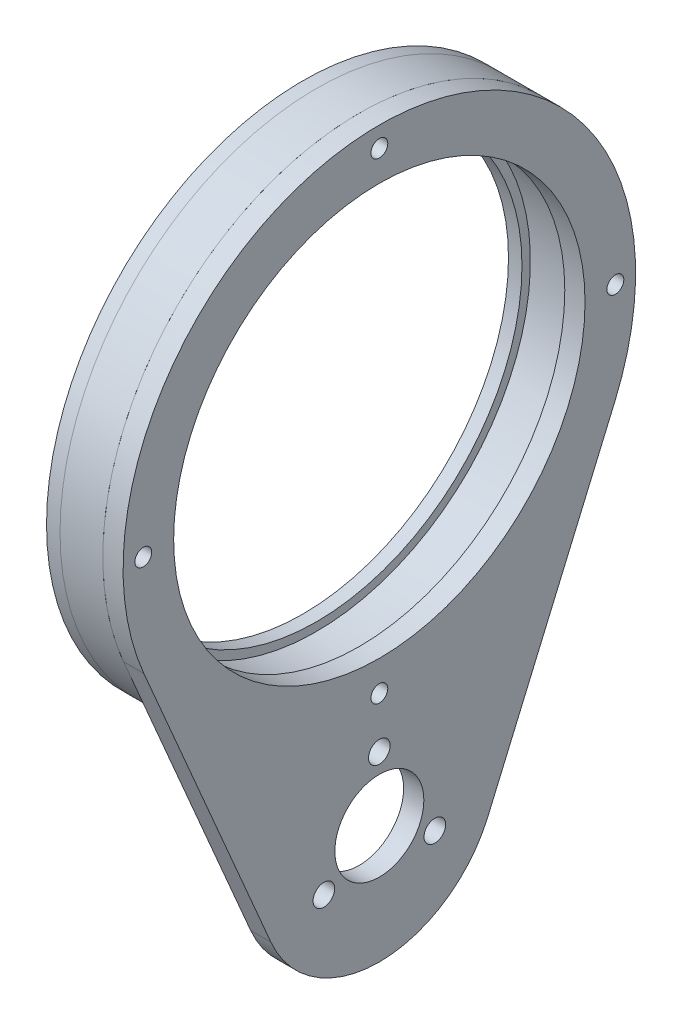
from build123d import *

# Parameters (mm, degrees)
SKETCH_2_R      = 6.6
SKETCH_2_R_2    = 1.6
SKETCH_2_R_3    = 30.5
SKETCH_2_R_4    = 1.25
EXTRUDE_1_DEPTH = 3
SKETCH_6_R      = 38
SKETCH_6_R_2    = 31.75
SKETCH_6_R_3    = 1.6
EXTRUDE_4_DEPTH = 6.35
SKETCH_7_R      = 38
SKETCH_7_R_2    = 30.5
SKETCH_7_R_3    = 1.6
EXTRUDE_5_DEPTH = 2


with BuildPart() as part:
    # ｽｹｯﾁ2 → ﾎﾞｽ - 押し出し1 (new body)
    with BuildSketch(Plane(origin=(0, 0, 0), x_dir=(0, 0, -1), z_dir=(1, 0, 0))):
        with BuildLine():
            Line((-34.922436245, 37.019230769), (-16.082700902, -6.899038462))
            ThreePointArc((-16.082700902, -6.899038462), (0, -17.5), (16.082700902, -6.899038462))
            Line((16.082700902, -6.899038462), (34.922436245, 37.019230769))
            ThreePointArc((34.922436245, 37.019230769), (0, 90), (-34.922436245, 37.019230769))
        make_face()
        Circle(SKETCH_2_R, mode=Mode.SUBTRACT)
        with Locations((0, 9.5)):
            Circle(SKETCH_2_R_2, mode=Mode.SUBTRACT)
        with Locations((8.227241336, -4.75)):
            Circle(SKETCH_2_R_2, mode=Mode.SUBTRACT)
        with Locations((-8.227241336, -4.75)):
            Circle(SKETCH_2_R_2, mode=Mode.SUBTRACT)
        with Locations((0, 52)):
            Circle(SKETCH_2_R_3, mode=Mode.SUBTRACT)
        with Locations((0, 87)):
            Circle(SKETCH_2_R_4, mode=Mode.SUBTRACT)
        with Locations((0, 17)):
            Circle(SKETCH_2_R_4, mode=Mode.SUBTRACT)
        with Locations((35, 52)):
            Circle(SKETCH_2_R_4, mode=Mode.SUBTRACT)
        with Locations((-35, 52)):
            Circle(SKETCH_2_R_4, mode=Mode.SUBTRACT)
    extrude(amount=EXTRUDE_1_DEPTH)


with BuildPart() as body_2:
    # ｽｹｯﾁ6 → ﾎﾞｽ - 押し出し4 (new body)
    with BuildSketch(Plane.ZY):
        with Locations((0, 52)):
            Circle(SKETCH_6_R)
        with Locations((0, 52)):
            Circle(SKETCH_6_R_2, mode=Mode.SUBTRACT)
        with Locations((0, 87)):
            Circle(SKETCH_6_R_3, mode=Mode.SUBTRACT)
        with Locations((35, 52)):
            Circle(SKETCH_6_R_3, mode=Mode.SUBTRACT)
        with Locations((0, 17)):
            Circle(SKETCH_6_R_3, mode=Mode.SUBTRACT)
        with Locations((-35, 52)):
            Circle(SKETCH_6_R_3, mode=Mode.SUBTRACT)
    extrude(amount=EXTRUDE_4_DEPTH)


with BuildPart() as body_3:
    # ｽｹｯﾁ7 → ﾎﾞｽ - 押し出し5 (new body)
    with BuildSketch(Plane.ZY.offset(6.35)):
        with Locations((0, 52)):
            Circle(SKETCH_7_R)
        with Locations((0, 52)):
            Circle(SKETCH_7_R_2, mode=Mode.SUBTRACT)
        with Locations((0, 17)):
            Circle(SKETCH_7_R_3, mode=Mode.SUBTRACT)
        with Locations((35, 52)):
            Circle(SKETCH_7_R_3, mode=Mode.SUBTRACT)
        with Locations((-35, 52)):
            Circle(SKETCH_7_R_3, mode=Mode.SUBTRACT)
        with Locations((0, 87)):
            Circle(SKETCH_7_R_3, mode=Mode.SUBTRACT)
    extrude(amount=EXTRUDE_5_DEPTH)


solid = Compound([part.part, body_2.part, body_3.part])
